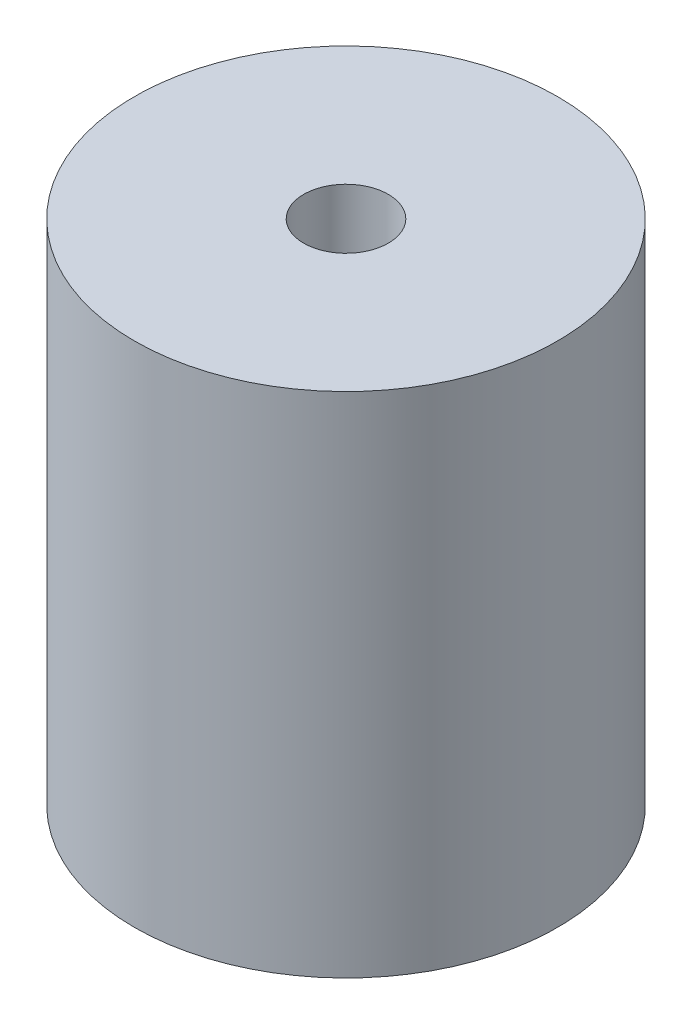
from build123d import *

# Parameters (mm, degrees)
SKETCH2_R           = 12.5
BOSS_EXTRUDE1_DEPTH = 15
SKETCH3_R           = 2.5
CUT_EXTRUDE1_DEPTH  = 15
SKETCH4_R           = 5
CUT_EXTRUDE2_DEPTH  = 15


with BuildPart() as part:
    # Sketch2 → Boss-Extrude1 (new, symmetric)
    with BuildSketch(Plane(origin=(0, 0, 0), x_dir=(1, 0, 0), z_dir=(0, 1, 0))):
        with Locations(Location((0, 0, 0), (0, 0, 270))):
            Circle(SKETCH2_R)
    extrude(amount=BOSS_EXTRUDE1_DEPTH, both=True)

    # Sketch3 → Cut-Extrude1 (cut)
    with BuildSketch(Plane(origin=(0, 15, 0), x_dir=(1, 0, 0), z_dir=(0, 1, 0))):
        with Locations(Location((0, 0, 0), (0, 0, 270))):
            Circle(SKETCH3_R)
    extrude(amount=-CUT_EXTRUDE1_DEPTH, mode=Mode.SUBTRACT)

    # Sketch4 → Cut-Extrude2 (cut)
    with BuildSketch(Plane.XZ.offset(15)):
        with Locations(Location((0, 0, 0), (0, 0, 270))):
            Circle(SKETCH4_R)
    extrude(amount=-CUT_EXTRUDE2_DEPTH, mode=Mode.SUBTRACT)


solid = part.part
